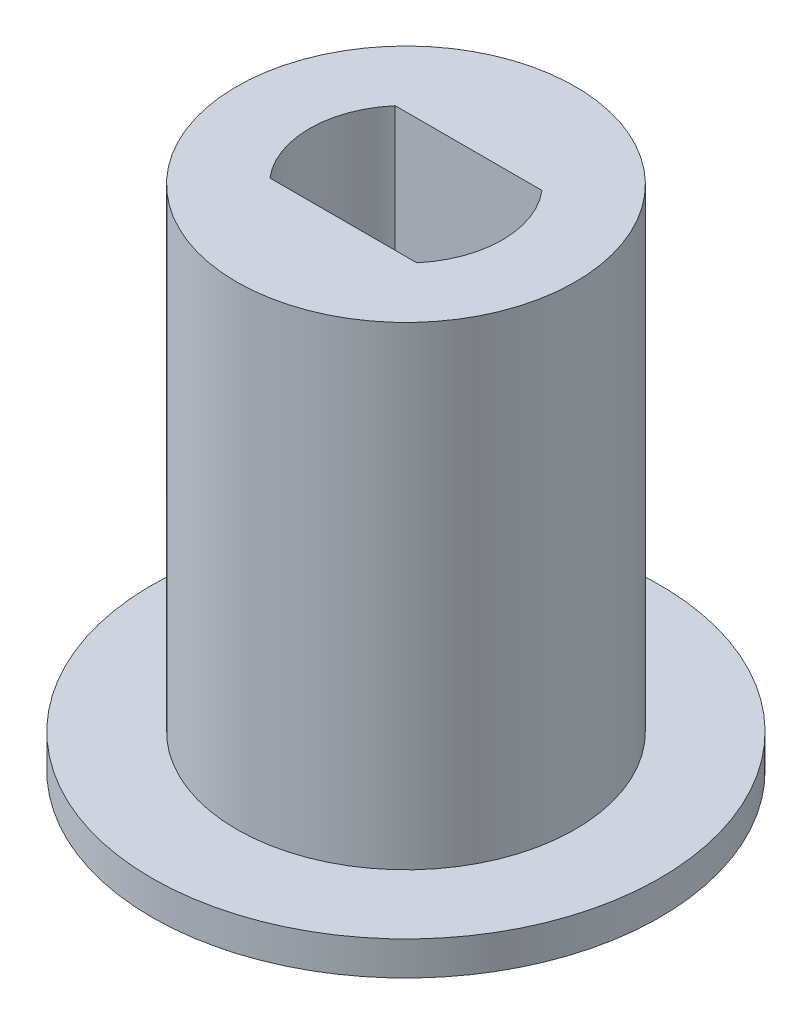
from build123d import *

# Parameters (mm, degrees)
SKETCH1_R            = 10
BOSS_EXTRUDE2_DEPTH  = 1
SKETCH3_R            = 5
BOSS_EXTRUDE3_DEPTH  = 14
CUT_EXTRUDE1_DEPTH   = 19
SKETCH5_R            = 12.5
BOSS_EXTRUDE4_DEPTH  = 1
CUT_EXTRUDE2_DEPTH   = 19
BOSS_EXTRUDE5_DEPTH  = 2
SKETCH8_R            = 7.5
BOSS_EXTRUDE6_DEPTH  = 2
SKETCH9_R            = 1
CUT_EXTRUDE3_DEPTH   = 25
CUT_EXTRUDE4_DEPTH   = 2
BOSS_EXTRUDE7_DEPTH  = 10
SKETCH14_R           = 1
CUT_EXTRUDE5_DEPTH   = 18
SKETCH15_R           = 1
BOSS_EXTRUDE8_DEPTH  = 17
SKETCH16_R           = 1
CUT_EXTRUDE7_DEPTH   = 10
CUT_EXTRUDE8_START   = -2
CUT_EXTRUDE8_DEPTH   = 2
SKETCH18_R           = 7.5
BOSS_EXTRUDE9_DEPTH  = 1.75
SKETCH19_R           = 7.5
SKETCH19_R_2         = 6.5
CUT_EXTRUDE9_DEPTH   = 1.75
BOSS_EXTRUDE11_START = -15
BOSS_EXTRUDE11_DEPTH = 15
SKETCH23_R           = 1
CUT_EXTRUDE10_DEPTH  = 8.75
SKETCH24_R           = 12.5
SKETCH24_R_2         = 7.5
CUT_EXTRUDE11_DEPTH  = 10
CUT_EXTRUDE12_START  = -10
SKETCH25_R           = 7.5
CUT_EXTRUDE12_DEPTH  = 10


with BuildPart() as part:
    # Sketch1 → Boss-Extrude2 (new body)
    with BuildSketch(Plane(origin=(0, 0, 0), x_dir=(1, 0, 0), z_dir=(0, 1, 0))):
        with Locations(Location((0, 0, 0), (0, 0, 270))):
            Circle(SKETCH1_R)
    extrude(amount=BOSS_EXTRUDE2_DEPTH)

    # Sketch3 → Boss-Extrude3 (add)
    with BuildSketch(Plane(origin=(0, 1, 0), x_dir=(1, 0, 0), z_dir=(0, 1, 0))):
        with Locations(Location((0, 0, 0), (0, 0, 270))):
            Circle(SKETCH3_R)
    extrude(amount=BOSS_EXTRUDE3_DEPTH)

    # Sketch4 → Cut-Extrude1 (cut)
    with BuildSketch(Plane(origin=(0, 15, 0), x_dir=(1, 0, 0), z_dir=(0, 1, 0))):
        with BuildLine():
            Line((0, -2), (0, 2))
            Line((0, 2), (-2.236067977, 2))
            ThreePointArc((-2.236067977, 2), (-3, 0), (-2.236067977, -2))
            Line((-2.236067977, -2), (0, -2))
        make_face()
        with BuildLine():
            Line((2.236067977, 2), (0, 2))
            Line((0, 2), (0, -2))
            Line((0, -2), (2.236067977, -2))
            ThreePointArc((2.236067977, -2), (2.802517077, -1.070466269), (3, 0))
            ThreePointArc((3, 0), (2.802517077, 1.070466269), (2.236067977, 2))
        make_face()
    extrude(amount=-CUT_EXTRUDE1_DEPTH, mode=Mode.SUBTRACT)

    # Sketch5 → Boss-Extrude4 (add)
    with BuildSketch(Plane(origin=(0, 1, 0), x_dir=(1, 0, 0), z_dir=(0, 1, 0))):
        with Locations(Location((0, 0, 0), (0, 0, 270))):
            Circle(SKETCH5_R)
    extrude(amount=-BOSS_EXTRUDE4_DEPTH)

    # Sketch6 → Cut-Extrude2 (cut)
    with BuildSketch(Plane(origin=(0, 1, 0), x_dir=(1, 0, 0), z_dir=(0, 1, 0))):
        with BuildLine():
            Line((2.236067977, 2), (-2.236067977, 2))
            ThreePointArc((-2.236067977, 2), (-3, 0), (-2.236067977, -2))
            Line((-2.236067977, -2), (2.236067977, -2))
            ThreePointArc((2.236067977, -2), (3, 0), (2.236067977, 2))
        make_face()
    extrude(amount=-CUT_EXTRUDE2_DEPTH, mode=Mode.SUBTRACT)

    # Sketch22 → Boss-Extrude11 (add)
    with BuildSketch(Plane.XZ.offset(BOSS_EXTRUDE11_START)):
        with BuildLine():
            Line((-2.236067977, 2), (2.236067977, 2))
            ThreePointArc((2.236067977, 2), (3, 0), (2.236067977, -2))
            Line((2.236067977, -2), (-2.236067977, -2))
            ThreePointArc((-2.236067977, -2), (-3, 0), (-2.236067977, 2))
        make_face()
        with BuildLine():
            ThreePointArc((2.167948339, -1.85), (2.85, 0), (2.167948339, 1.85))
            Line((2.167948339, 1.85), (-2.167948339, 1.85))
            ThreePointArc((-2.167948339, 1.85), (-2.85, 0), (-2.167948339, -1.85))
            Line((-2.167948339, -1.85), (2.167948339, -1.85))
        make_face(mode=Mode.SUBTRACT)
    extrude(amount=BOSS_EXTRUDE11_DEPTH)

    # Sketch24 → Cut-Extrude11 (cut)
    with BuildSketch(Plane(origin=(0, 1, 0), x_dir=(1, 0, 0), z_dir=(0, 1, 0))):
        Circle(SKETCH24_R)
        with Locations(Location((0, 0, 0), (0, 0, 270))):
            Circle(SKETCH24_R_2, mode=Mode.SUBTRACT)
    extrude(amount=-CUT_EXTRUDE11_DEPTH, mode=Mode.SUBTRACT)


with BuildPart() as body_2:
    # Sketch7 → Boss-Extrude5 (new body)
    with BuildSketch(Plane(origin=(0, 15, 0), x_dir=(1, 0, 0), z_dir=(0, 1, 0))):
        with BuildLine():
            Line((-2.236067977, -2), (2.236067977, -2))
            ThreePointArc((2.236067977, -2), (3, 0), (2.236067977, 2))
            Line((2.236067977, 2), (-2.236067977, 2))
            ThreePointArc((-2.236067977, 2), (-3, 0), (-2.236067977, -2))
        make_face()
    extrude(amount=BOSS_EXTRUDE5_DEPTH)

    # Sketch8 → Boss-Extrude6 (add)
    with BuildSketch(Plane(origin=(0, 17, 0), x_dir=(1, 0, 0), z_dir=(0, 1, 0))):
        with Locations(Location((0, 0, 0), (0, 0, 270))):
            Circle(SKETCH8_R)
    extrude(amount=BOSS_EXTRUDE6_DEPTH)

    # Sketch9 → Cut-Extrude3 (cut)
    with BuildSketch(Plane(origin=(0, 19, 0), x_dir=(1, 0, 0), z_dir=(0, 1, 0))):
        with Locations(Location((0, 0, 0), (0, 0, 270))):
            Circle(SKETCH9_R)
    extrude(amount=-CUT_EXTRUDE3_DEPTH, mode=Mode.SUBTRACT)

    # Sketch10 → Cut-Extrude4 (cut)
    with BuildSketch(Plane.XZ.offset(-15)):
        with BuildLine():
            Line((-2.121320344, -1.75), (2.121320344, -1.75))
            ThreePointArc((2.121320344, -1.75), (2.75, 0), (2.121320344, 1.75))
            Line((2.121320344, 1.75), (-2.121320344, 1.75))
            ThreePointArc((-2.121320344, 1.75), (-2.75, 0), (-2.121320344, -1.75))
        make_face()
    extrude(amount=-CUT_EXTRUDE4_DEPTH, mode=Mode.SUBTRACT)

    # Sketch11 → Boss-Extrude7 (add)
    with BuildSketch(Plane.XZ.offset(-17)):
        with BuildLine():
            Line((-2.121320344, -1.75), (2.121320344, -1.75))
            ThreePointArc((2.121320344, -1.75), (2.75, 0), (2.121320344, 1.75))
            Line((2.121320344, 1.75), (-2.121320344, 1.75))
            ThreePointArc((-2.121320344, 1.75), (-2.75, 0), (-2.121320344, -1.75))
        make_face()
    extrude(amount=BOSS_EXTRUDE7_DEPTH)

    # Sketch14 → Cut-Extrude5 (cut)
    with BuildSketch(Plane(origin=(0, 17, 0), x_dir=(1, 0, 0), z_dir=(0, 1, 0))):
        with Locations(Location((0, 0, 0), (0, 0, 270))):
            Circle(SKETCH14_R)
    extrude(amount=-CUT_EXTRUDE5_DEPTH, mode=Mode.SUBTRACT)

    # Sketch15 → Boss-Extrude8 (add)
    with BuildSketch(Plane.XZ.offset(-7)):
        with BuildLine():
            Line((-2.121320344, -1.75), (2.121320344, -1.75))
            ThreePointArc((2.121320344, -1.75), (2.75, 0), (2.121320344, 1.75))
            Line((2.121320344, 1.75), (-2.121320344, 1.75))
            ThreePointArc((-2.121320344, 1.75), (-2.75, 0), (-2.121320344, -1.75))
        make_face()
        with Locations(Location((0, 0, 0), (0, 0, 270))):
            Circle(SKETCH15_R, mode=Mode.SUBTRACT)
    extrude(amount=-BOSS_EXTRUDE8_DEPTH)

    # Sketch16 → Cut-Extrude7 (cut)
    with BuildSketch(Plane.XZ.offset(-7)):
        with BuildLine():
            Line((-2.121320344, -1.75), (2.121320344, -1.75))
            ThreePointArc((2.121320344, -1.75), (2.75, 0), (2.121320344, 1.75))
            Line((2.121320344, 1.75), (-2.121320344, 1.75))
            ThreePointArc((-2.121320344, 1.75), (-2.75, 0), (-2.121320344, -1.75))
        make_face()
        with Locations(Location((0, 0, 0), (0, 0, 90))):
            Circle(SKETCH16_R, mode=Mode.SUBTRACT)
    extrude(amount=-CUT_EXTRUDE7_DEPTH, mode=Mode.SUBTRACT)

    # Sketch17 → Cut-Extrude8 (cut)
    with BuildSketch(Plane.XZ.offset(-15).offset(CUT_EXTRUDE8_START)):
        with BuildLine():
            Line((-2.236067977, -2), (2.236067977, -2))
            ThreePointArc((2.236067977, -2), (3, 0), (2.236067977, 2))
            Line((2.236067977, 2), (-2.236067977, 2))
            ThreePointArc((-2.236067977, 2), (-3, 0), (-2.236067977, -2))
        make_face()
    extrude(amount=CUT_EXTRUDE8_DEPTH, mode=Mode.SUBTRACT)

    # Sketch18 → Boss-Extrude9 (add)
    with BuildSketch(Plane.XZ.offset(-17)):
        with Locations(Location((0, 0, 0), (0, 0, 270))):
            Circle(SKETCH18_R)
    extrude(amount=BOSS_EXTRUDE9_DEPTH)

    # Sketch19 → Cut-Extrude9 (cut)
    # profile 1 of 2: a face of its own
    with BuildSketch(Plane(origin=(0, 19, 0), x_dir=(1, 0, 0), z_dir=(0, 1, 0))):
        with Locations(Location((0, 0, 0), (0, 0, 90))):
            Circle(SKETCH19_R)
        Circle(SKETCH19_R_2, mode=Mode.SUBTRACT)
    # profile 2 of 2: a face of its own
    with BuildSketch(Plane(origin=(0, 19, 0), x_dir=(1, 0, 0), z_dir=(0, 1, 0))):
        Circle(SKETCH19_R_2)
        with BuildLine():
            Line((2.121320344, -1.75), (-2.121320344, -1.75))
            ThreePointArc((-2.121320344, -1.75), (-2.75, 0), (-2.121320344, 1.75))
            Line((-2.121320344, 1.75), (2.121320344, 1.75))
            ThreePointArc((2.121320344, 1.75), (2.75, 0), (2.121320344, -1.75))
        make_face(mode=Mode.SUBTRACT)
    extrude(amount=-CUT_EXTRUDE9_DEPTH, mode=Mode.SUBTRACT)

    # Sketch23 → Cut-Extrude10 (cut)
    with BuildSketch(Plane(origin=(0, 24, 0), x_dir=(1, 0, 0), z_dir=(0, 1, 0))):
        with Locations(Location((0, 0, 0), (0, 0, 90))):
            Circle(SKETCH23_R)
    extrude(amount=-CUT_EXTRUDE10_DEPTH, mode=Mode.SUBTRACT)

    # Sketch25 → Cut-Extrude12 (cut)
    with BuildSketch(Plane.XZ.offset(-15.25).offset(CUT_EXTRUDE12_START)):
        with Locations(Location((0, 0, 0), (0, 0, 90))):
            Circle(SKETCH25_R)
    extrude(amount=CUT_EXTRUDE12_DEPTH, mode=Mode.SUBTRACT)


solid = part.part
